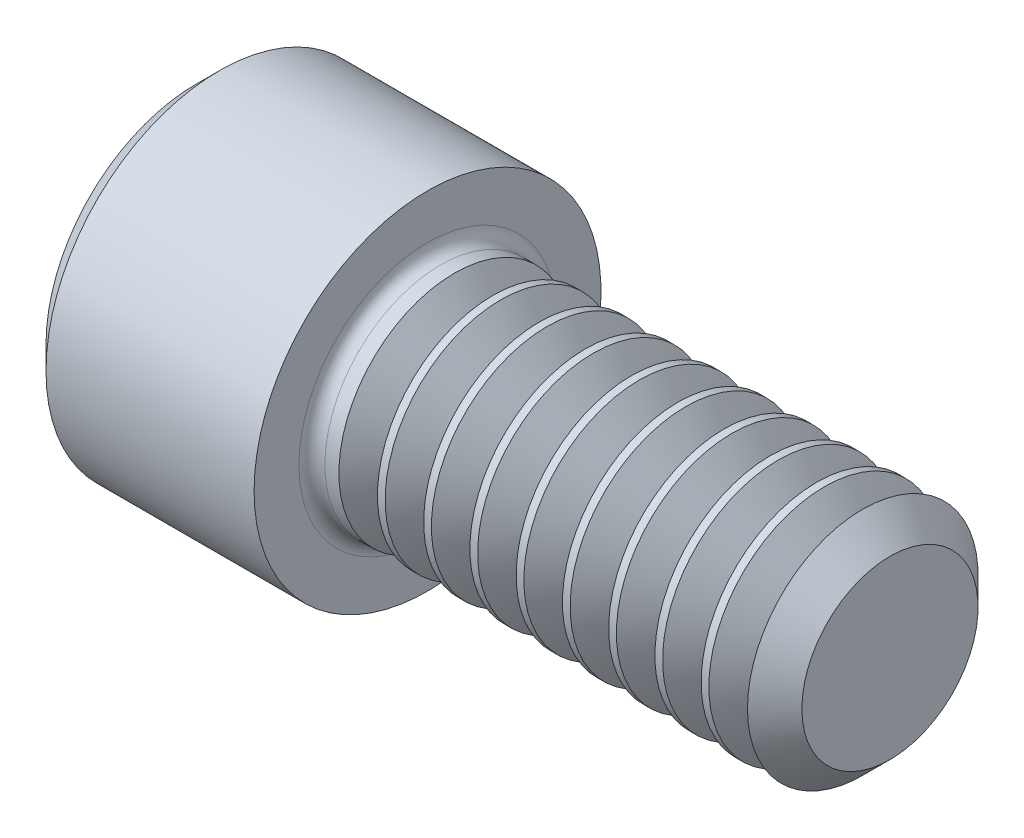
from build123d import *

# Parameters (mm, degrees)
FILLET1_R       = 0.3556
HEX_2_DEPTH     = 3.048
THDSCHPAT_COUNT = 9
THDSCHPAT_PITCH = 1.27


with BuildPart() as part:
    # BodySke → Base-Revolve (revolve)
    with BuildSketch(Plane.XY, mode=Mode.PRIVATE) as base_revolve_sk:
        Polygon((0, 0), (0, 4.1275), (0.635, 4.7625), (6.35, 4.7625), (6.35, 3.175), (18.29435, 3.175), (19.05, 2.41935), (19.05, 0), align=None)
    revolve(base_revolve_sk.sketch.rotate(Axis((-31.75, 0, 0), (1, 0, 0)), 90), axis=Axis((-31.75, 0, 0), (1, 0, 0)))

    # Fillet1
    fillet1_edges = [part.edges().sort_by_distance(p)[0] for p in [
        (6.35, 0, -3.175),
    ]]
    fillet(fillet1_edges, radius=FILLET1_R)

    # Sketch2 → Hex-PreBroach (revolve, cut)
    with BuildSketch(Plane.XY, mode=Mode.PRIVATE) as hex_prebroach_sk:
        Polygon((0, 2.38125), (3.048, 2.38125), (4.422815329, 0), (0, 0), align=None)
    revolve(hex_prebroach_sk.sketch.rotate(Axis((0, 0, 0), (1, 0, 0)), 90), axis=Axis((0, 0, 0), (1, 0, 0)), mode=Mode.SUBTRACT)

    # Sketch3 → Hex 2 (cut)
    with BuildSketch(Plane(origin=(0, 0, 0), x_dir=(0, 0.500000000000001, 0.866025403784438), z_dir=(-1, 0, 0))):
        Polygon((1.374815329, 2.38125), (-1.374815329, 2.38125), (-2.749630657, 0), (-1.374815329, -2.38125), (1.374815329, -2.38125), (2.749630657, 0), align=None)
    extrude(amount=-HEX_2_DEPTH, mode=Mode.SUBTRACT)

    # ThdSchSke → ThreadSchematic (revolve, cut)
    with BuildSketch(Plane.XY):
        Polygon((7.62, -2.41935), (7.090888174, -3.175), (7.090888174, -3.96875), (8.149111826, -3.96875), (8.149111826, -3.175), align=None)
    threadschematic = revolve(axis=Axis((-3.175, 0, 0), (1, 0, 0)), mode=Mode.SUBTRACT)

    # ThdSchPat: ThreadSchematic ×9
    with Locations(*[(i * THDSCHPAT_PITCH, 0, 0) for i in range(1, THDSCHPAT_COUNT)]):
        add(threadschematic, mode=Mode.SUBTRACT)


solid = part.part
